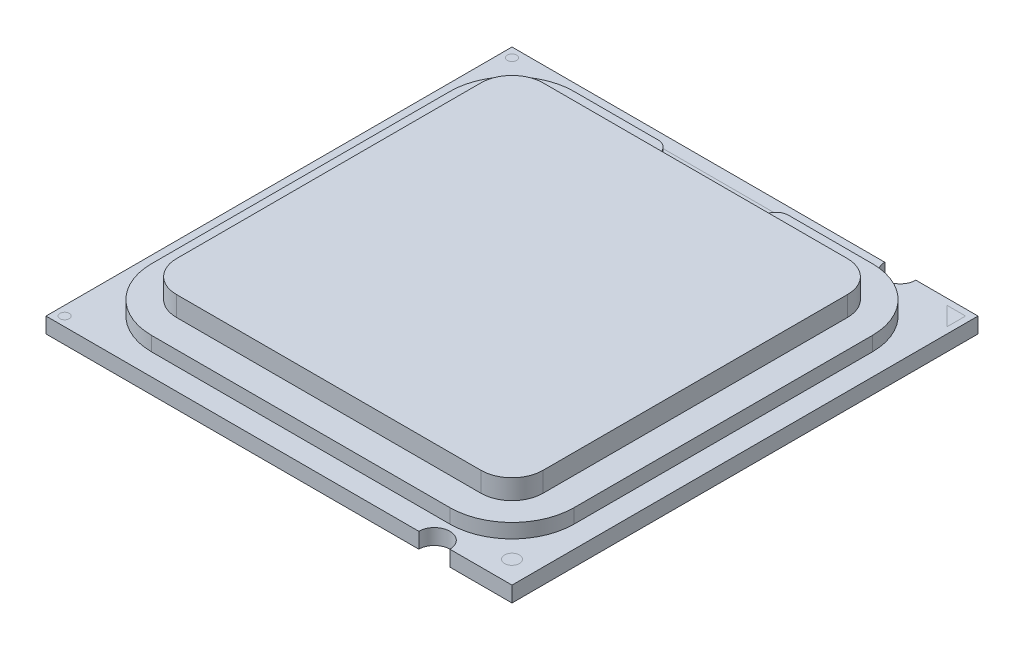
from build123d import *

# Parameters (mm, degrees)
BOSS_EXTRUDE1_DEPTH = 1.25
BOSS_EXTRUDE2_DEPTH = 2.4
BOSS_EXTRUDE3_DEPTH = 4


with BuildPart() as part:
    # Sketch1 → Boss-Extrude1 (new body)
    with BuildSketch(Plane(origin=(0, 0, 0), x_dir=(1, 0, 0), z_dir=(0, 1, 0))):
        with BuildLine():
            Line((18.75, 18.75), (13.75, 18.75))
            ThreePointArc((13.75, 18.75), (12.5, 17.5), (11.25, 18.75))
            Line((11.25, 18.75), (-18.75, 18.75))
            Line((-18.75, 18.75), (-18.75, -18.75))
            Line((-18.75, -18.75), (11.25, -18.75))
            ThreePointArc((11.25, -18.75), (12.5, -17.5), (13.75, -18.75))
            Line((13.75, -18.75), (18.75, -18.75))
            Line((18.75, -18.75), (18.75, 18.75))
        make_face()
    extrude(amount=BOSS_EXTRUDE1_DEPTH)

    # Sketch1<3> → Boss-Extrude2 (add)
    with BuildSketch(Plane(origin=(0, 0, 0), x_dir=(1, 0, 0), z_dir=(0, 1, 0))):
        with BuildLine():
            Line((-4.25, 15.75), (-4.25, 16))
            ThreePointArc((-4.25, 16), (-4.542893219, 16.707106781), (-5.25, 17))
            Line((-5.25, 17), (-12, 17))
            ThreePointArc((-12, 17), (-15.535533906, 15.535533906), (-17, 12))
            Line((-17, 12), (-17, -12))
            ThreePointArc((-17, -12), (-15.535533906, -15.535533906), (-12, -17))
            Line((-12, -17), (12, -17))
            ThreePointArc((12, -17), (15.535533906, -15.535533906), (17, -12))
            Line((17, -12), (17, 12))
            ThreePointArc((17, 12), (15.535533906, 15.535533906), (12, 17))
            Line((12, 17), (5.25, 17))
            ThreePointArc((5.25, 17), (4.542893219, 16.707106781), (4.25, 16))
            Line((4.25, 16), (4.25, 15.75))
            ThreePointArc((4.25, 15.75), (3.957106781, 15.042893219), (3.25, 14.75))
            Line((3.25, 14.75), (-3.25, 14.75))
            ThreePointArc((-3.25, 14.75), (-3.957106781, 15.042893219), (-4.25, 15.75))
        make_face()
    extrude(amount=BOSS_EXTRUDE2_DEPTH)

    # Sketch1<4> → Boss-Extrude3 (add)
    with BuildSketch(Plane(origin=(0, 0, 0), x_dir=(1, 0, 0), z_dir=(0, 1, 0))):
        with BuildLine():
            Line((3.25, 14.75), (-3.25, 14.75))
            Line((-3.25, 14.75), (-12.25, 14.75))
            ThreePointArc((-12.25, 14.75), (-14.017766953, 14.017766953), (-14.75, 12.25))
            Line((-14.75, 12.25), (-14.75, -12.25))
            ThreePointArc((-14.75, -12.25), (-14.017766953, -14.017766953), (-12.25, -14.75))
            Line((-12.25, -14.75), (12.25, -14.75))
            ThreePointArc((12.25, -14.75), (14.017766953, -14.017766953), (14.75, -12.25))
            Line((14.75, -12.25), (14.75, 12.25))
            ThreePointArc((14.75, 12.25), (14.017766953, 14.017766953), (12.25, 14.75))
            Line((12.25, 14.75), (3.25, 14.75))
        make_face()
    extrude(amount=BOSS_EXTRUDE3_DEPTH)


solid = part.part
